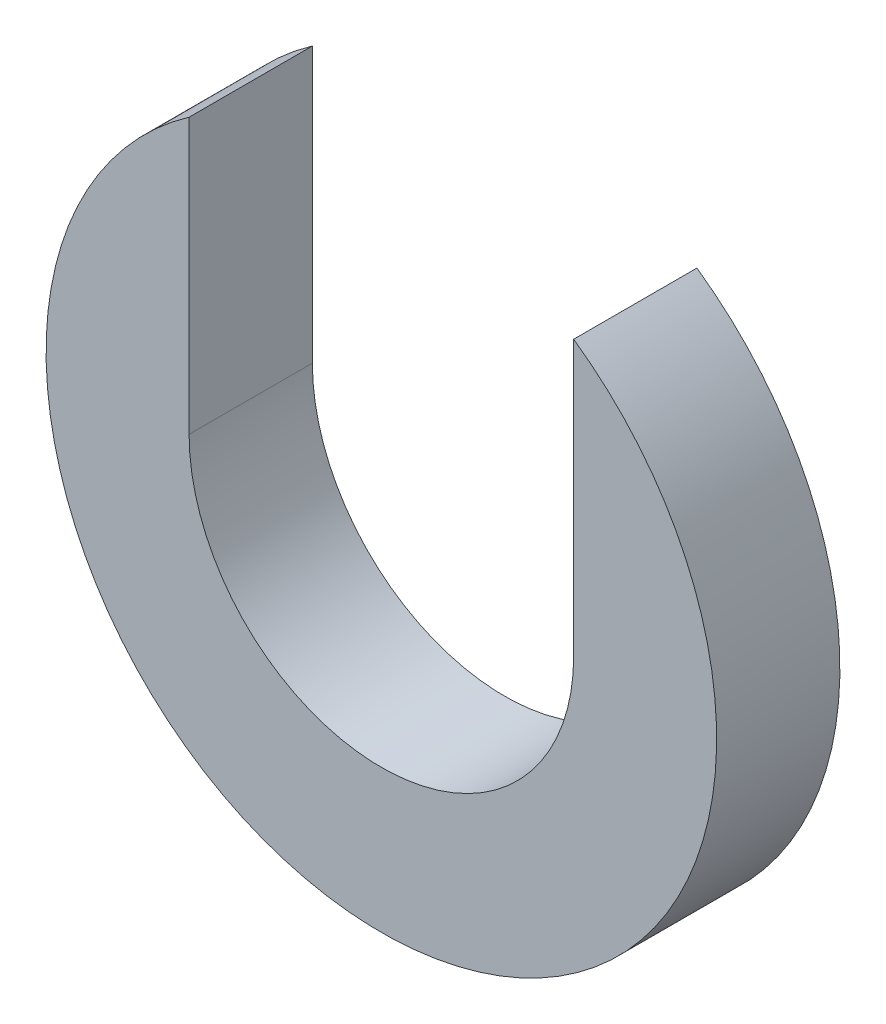
from build123d import *

# Parameters (mm, degrees)
BOSS_EXTRUDE1_DEPTH = 3.175


with BuildPart() as part:
    # Sketch1 → Boss-Extrude1 (new body)
    with BuildSketch(Plane.XY):
        with BuildLine():
            Line((-4.953, 0), (-4.953, 7.074481394))
            ThreePointArc((-4.953, 7.074481394), (0, -8.636), (4.953, 7.074481394))
            Line((4.953, 7.074481394), (4.953, 0))
            ThreePointArc((4.953, 0), (0, -4.953), (-4.953, 0))
        make_face()
    extrude(amount=BOSS_EXTRUDE1_DEPTH)


solid = part.part
